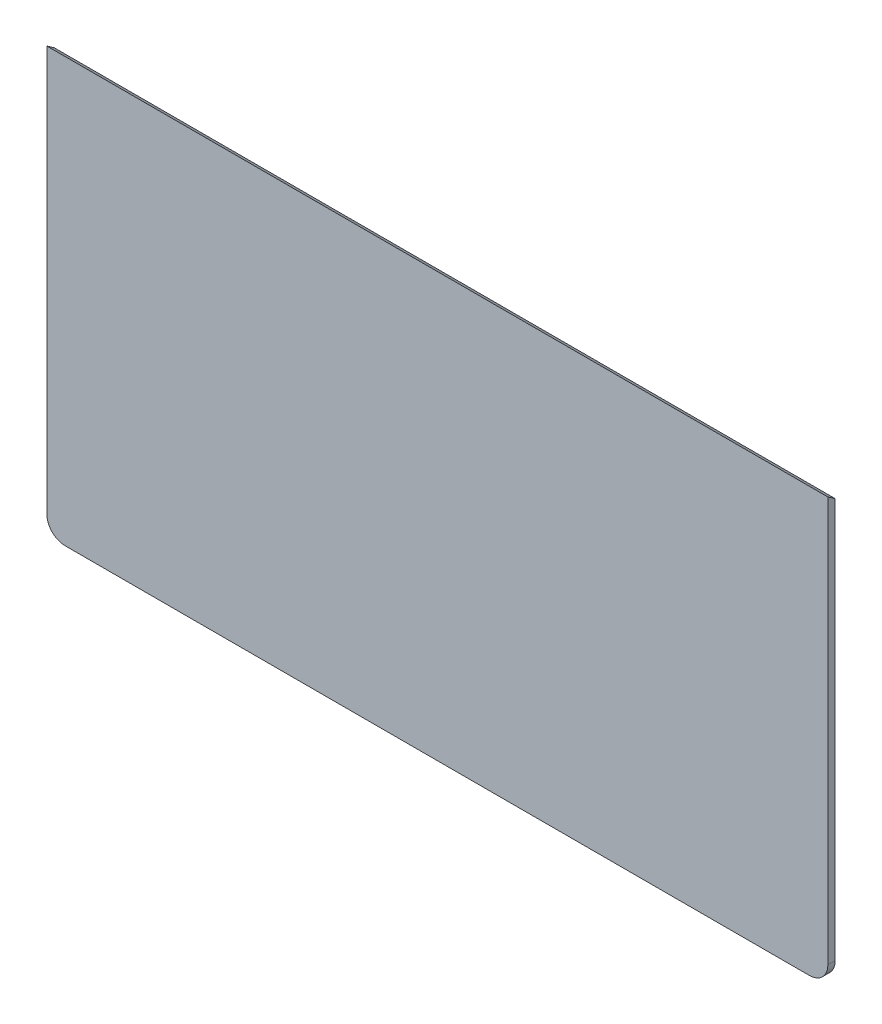
from build123d import *

# Parameters (mm, degrees)
SKETCH_1_W          = 424
SKETCH_1_H          = 230
EXTRUDE_1_DEPTH     = 4
FILLET_1_R          = 10
CUT_EXTRUDE_1_DEPTH = 440.337000491


with BuildPart() as part:
    # Эскиз1 → Бобышка-Вытянуть1 (new body)
    with BuildSketch(Plane.XY):
        Rectangle(SKETCH_1_W, SKETCH_1_H)
    extrude(amount=EXTRUDE_1_DEPTH)

    # Скругление1
    fillet_1_edges = [part.edges().sort_by_distance(p)[0] for p in [
        (212, -115, 2),
        (-212, -115, 2),
    ]]
    fillet(fillet_1_edges, radius=FILLET_1_R)

    # Эскиз2 → Вырез-Вытянуть1 (cut, through all)
    with BuildSketch(Plane(origin=(212, 0, 0), x_dir=(0, 0, -1), z_dir=(1, 0, 0))):
        Polygon((-4, 115), (0, 112.199169847), (0, 115), align=None)
    extrude(amount=-CUT_EXTRUDE_1_DEPTH, mode=Mode.SUBTRACT)


solid = part.part
